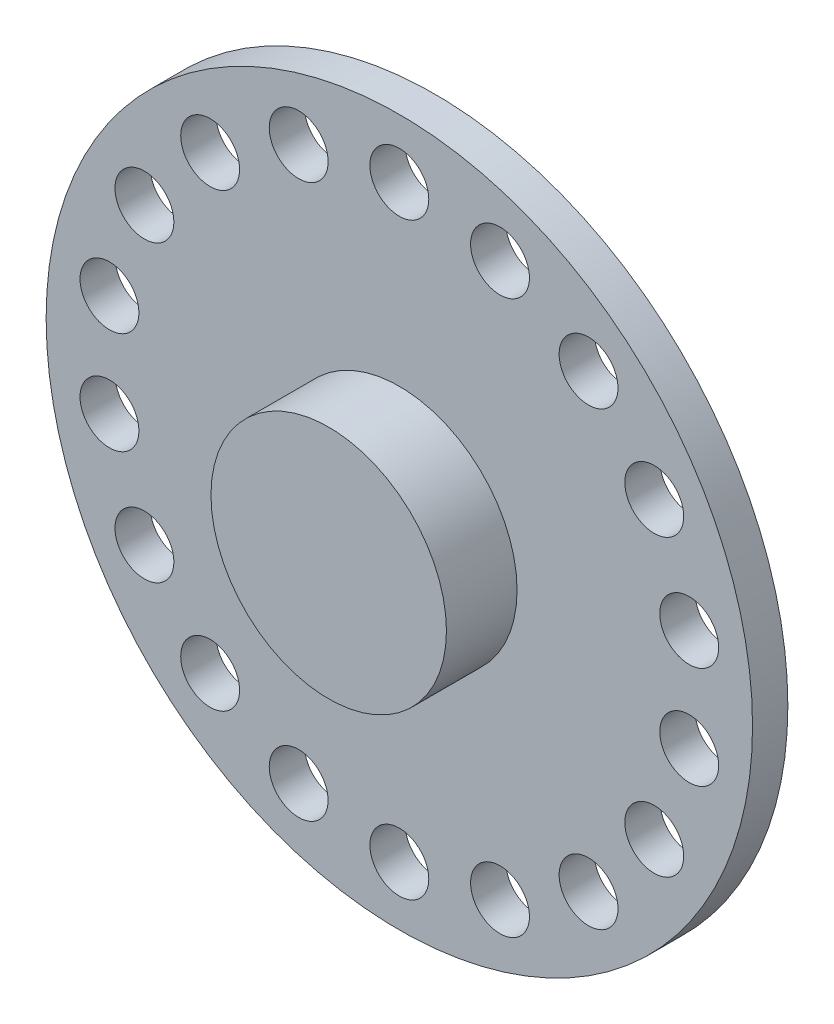
from build123d import *

# Parameters (mm, degrees)
SKETCH1_R           = 30
BOSS_EXTRUDE1_DEPTH = 3
SKETCH2_R           = 10
BOSS_EXTRUDE2_DEPTH = 6
SKETCH3_R           = 2.5
CUT_EXTRUDE1_DEPTH  = 44.370496884


with BuildPart() as part:
    # Sketch1 → Boss-Extrude1 (new body)
    with BuildSketch(Plane.XY):
        Circle(SKETCH1_R)
    extrude(amount=BOSS_EXTRUDE1_DEPTH)

    # Sketch2 → Boss-Extrude2 (add)
    with BuildSketch(Plane.XY.offset(3)):
        Circle(SKETCH2_R)
    extrude(amount=BOSS_EXTRUDE2_DEPTH)

    # Sketch3 → Cut-Extrude1 (cut, through all)
    with BuildSketch(Plane(origin=(0, 0, 0), x_dir=(-1, 0, 0), z_dir=(0, 0, -1))):
        with Locations((0, 25)):
            Circle(SKETCH3_R)
        with Locations((8.550503583, 23.49231552)):
            Circle(SKETCH3_R)
        with Locations((16.069690242, 19.151111078)):
            Circle(SKETCH3_R)
        with Locations((21.650635095, 12.5)):
            Circle(SKETCH3_R)
        with Locations((24.620193825, 4.341204442)):
            Circle(SKETCH3_R)
        with Locations((24.620193825, -4.341204442)):
            Circle(SKETCH3_R)
        with Locations((21.650635095, -12.5)):
            Circle(SKETCH3_R)
        with Locations((16.069690242, -19.151111078)):
            Circle(SKETCH3_R)
        with Locations((8.550503583, -23.49231552)):
            Circle(SKETCH3_R)
        with Locations((0, -25)):
            Circle(SKETCH3_R)
        with Locations((-8.550503583, -23.49231552)):
            Circle(SKETCH3_R)
        with Locations((-16.069690242, -19.151111078)):
            Circle(SKETCH3_R)
        with Locations((-21.650635095, -12.5)):
            Circle(SKETCH3_R)
        with Locations((-24.620193825, -4.341204442)):
            Circle(SKETCH3_R)
        with Locations((-24.620193825, 4.341204442)):
            Circle(SKETCH3_R)
        with Locations((-21.650635095, 12.5)):
            Circle(SKETCH3_R)
        with Locations((-16.069690242, 19.151111078)):
            Circle(SKETCH3_R)
        with Locations((-8.550503583, 23.49231552)):
            Circle(SKETCH3_R)
    extrude(amount=-CUT_EXTRUDE1_DEPTH, mode=Mode.SUBTRACT)


solid = part.part
